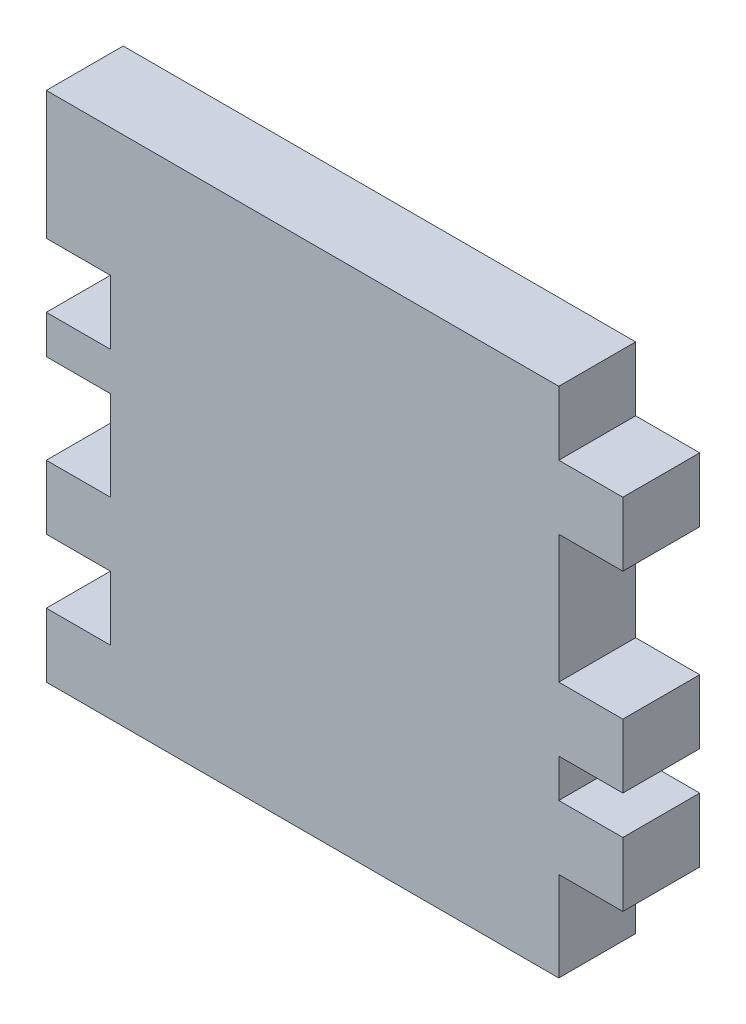
from build123d import *

# Parameters (mm, degrees)
SKETCH1_W           = 45
SKETCH1_H           = 40
BOSS_EXTRUDE1_DEPTH = 6
SKETCH2_W           = 5
SKETCH2_H           = 5
SKETCH2_H_2         = 7
CUT_EXTRUDE1_DEPTH  = 6
SKETCH3_W           = 5
SKETCH3_H           = 5
SKETCH3_H_2         = 3
SKETCH3_H_3         = 10
CUT_EXTRUDE2_DEPTH  = 6
SKETCH4_W           = 5
SKETCH4_H           = 7
CUT_EXTRUDE3_DEPTH  = 6


with BuildPart() as part:
    # Sketch1 → Boss-Extrude1 (new body)
    with BuildSketch(Plane.XY):
        with Locations((1.238898757, -2.615452931)):
            Rectangle(SKETCH1_W, SKETCH1_H)
    extrude(amount=BOSS_EXTRUDE1_DEPTH)

    # Sketch2 → Cut-Extrude1 (cut)
    with BuildSketch(Plane.XY.offset(6)):
        with Locations((-18.761101243, 4.884547069)):
            Rectangle(SKETCH2_W, SKETCH2_H)
        with Locations((-18.761101243, -4.115452931)):
            Rectangle(SKETCH2_W, SKETCH2_H_2)
        with Locations((-18.761101243, -15.115452931)):
            Rectangle(SKETCH2_W, SKETCH2_H)
    extrude(amount=-CUT_EXTRUDE1_DEPTH, mode=Mode.SUBTRACT)

    # Sketch3 → Cut-Extrude2 (cut)
    with BuildSketch(Plane.XY.offset(6)):
        with Locations((21.238898757, -20.115452931)):
            Rectangle(SKETCH3_W, SKETCH3_H)
        with Locations((21.238898757, -9.115452931)):
            Rectangle(SKETCH3_W, SKETCH3_H_2)
        with Locations((21.238898757, 14.884547069)):
            Rectangle(SKETCH3_W, SKETCH3_H)
        with Locations((21.238898757, 2.384547069)):
            Rectangle(SKETCH3_W, SKETCH3_H_3)
    extrude(amount=-CUT_EXTRUDE2_DEPTH, mode=Mode.SUBTRACT)

    # Sketch4 → Cut-Extrude3 (cut)
    with BuildSketch(Plane.XY.offset(6)):
        with Locations((21.238898757, -19.115452931)):
            Rectangle(SKETCH4_W, SKETCH4_H)
    extrude(amount=-CUT_EXTRUDE3_DEPTH, mode=Mode.SUBTRACT)


solid = part.part
